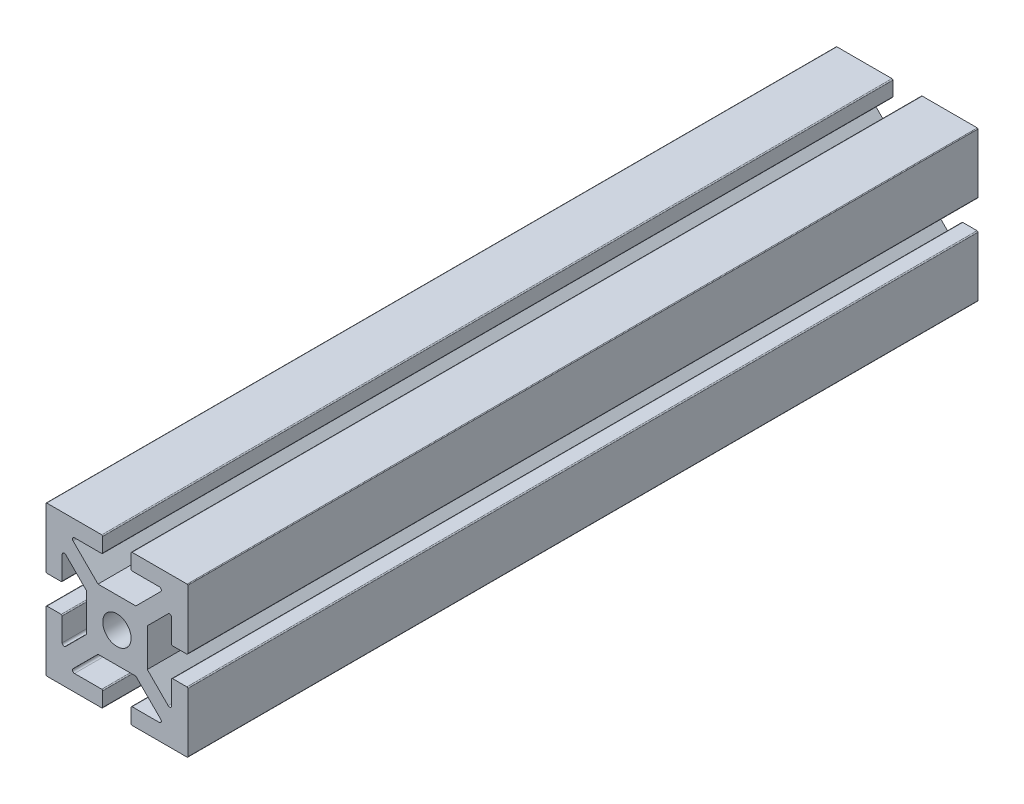
from build123d import *

# Parameters (mm, degrees)
SKETCH1_R           = 3.5
BOSS_EXTRUDE1_DEPTH = 195


with BuildPart() as part:
    # Sketch1 → Boss-Extrude1 (new body)
    with BuildSketch(Plane.XY):
        with BuildLine():
            Line((-7.5, -4.671572875), (-7.5, 4.671572875))
            Line((-7.5, 4.671572875), (-12.646446609, 9.818019485))
            ThreePointArc((-12.646446609, 9.818019485), (-13.191341716, 9.92640586), (-13.5, 9.464466094))
            Line((-13.5, 9.464466094), (-13.5, 3.75))
            ThreePointArc((-13.5, 3.75), (-13.573223305, 3.573223305), (-13.75, 3.5))
            Line((-13.75, 3.5), (-17.25, 3.5))
            ThreePointArc((-17.25, 3.5), (-17.426776695, 3.573223305), (-17.5, 3.75))
            Line((-17.5, 3.75), (-17.5, 18.323223305))
            ThreePointArc((-17.5, 18.323223305), (-17.448223305, 18.448223305), (-17.323223305, 18.5))
            Line((-17.323223305, 18.5), (-3.75, 18.5))
            ThreePointArc((-3.75, 18.5), (-3.573223305, 18.426776695), (-3.5, 18.25))
            Line((-3.5, 18.25), (-3.5, 14.75))
            ThreePointArc((-3.5, 14.75), (-3.573223305, 14.573223305), (-3.75, 14.5))
            Line((-3.75, 14.5), (-10.464466094, 14.5))
            ThreePointArc((-10.464466094, 14.5), (-10.92640586, 14.191341716), (-10.818019485, 13.646446609))
            Line((-10.818019485, 13.646446609), (-4.671572875, 7.5))
            Line((-4.671572875, 7.5), (4.671572875, 7.5))
            Line((4.671572875, 7.5), (10.818019485, 13.646446609))
            ThreePointArc((10.818019485, 13.646446609), (10.92640586, 14.191341716), (10.464466094, 14.5))
            Line((10.464466094, 14.5), (3.75, 14.5))
            ThreePointArc((3.75, 14.5), (3.573223305, 14.573223305), (3.5, 14.75))
            Line((3.5, 14.75), (3.5, 18.25))
            ThreePointArc((3.5, 18.25), (3.573223305, 18.426776695), (3.75, 18.5))
            Line((3.75, 18.5), (17.323223305, 18.5))
            ThreePointArc((17.323223305, 18.5), (17.448223305, 18.448223305), (17.5, 18.323223305))
            Line((17.5, 18.323223305), (17.5, 3.75))
            ThreePointArc((17.5, 3.75), (17.426776695, 3.573223305), (17.25, 3.5))
            Line((17.25, 3.5), (13.75, 3.5))
            ThreePointArc((13.75, 3.5), (13.573223305, 3.573223305), (13.5, 3.75))
            Line((13.5, 3.75), (13.5, 9.464466094))
            ThreePointArc((13.5, 9.464466094), (13.191341716, 9.92640586), (12.646446609, 9.818019485))
            Line((12.646446609, 9.818019485), (7.5, 4.671572875))
            Line((7.5, 4.671572875), (7.5, -4.671572875))
            Line((7.5, -4.671572875), (12.646446609, -9.818019485))
            ThreePointArc((12.646446609, -9.818019485), (13.191341716, -9.92640586), (13.5, -9.464466094))
            Line((13.5, -9.464466094), (13.5, -3.75))
            ThreePointArc((13.5, -3.75), (13.573223305, -3.573223305), (13.75, -3.5))
            Line((13.75, -3.5), (17.25, -3.5))
            ThreePointArc((17.25, -3.5), (17.426776695, -3.573223305), (17.5, -3.75))
            Line((17.5, -3.75), (17.5, -18.323223305))
            ThreePointArc((17.5, -18.323223305), (17.448223305, -18.448223305), (17.323223305, -18.5))
            Line((17.323223305, -18.5), (3.75, -18.5))
            ThreePointArc((3.75, -18.5), (3.573223305, -18.426776695), (3.5, -18.25))
            Line((3.5, -18.25), (3.5, -14.75))
            ThreePointArc((3.5, -14.75), (3.573223305, -14.573223305), (3.75, -14.5))
            Line((3.75, -14.5), (10.464466094, -14.5))
            ThreePointArc((10.464466094, -14.5), (10.92640586, -14.191341716), (10.818019485, -13.646446609))
            Line((10.818019485, -13.646446609), (4.671572875, -7.5))
            Line((4.671572875, -7.5), (-4.671572875, -7.5))
            Line((-4.671572875, -7.5), (-10.818019485, -13.646446609))
            ThreePointArc((-10.818019485, -13.646446609), (-10.92640586, -14.191341716), (-10.464466094, -14.5))
            Line((-10.464466094, -14.5), (-3.75, -14.5))
            ThreePointArc((-3.75, -14.5), (-3.573223305, -14.573223305), (-3.5, -14.75))
            Line((-3.5, -14.75), (-3.5, -18.25))
            ThreePointArc((-3.5, -18.25), (-3.573223305, -18.426776695), (-3.75, -18.5))
            Line((-3.75, -18.5), (-17.323223305, -18.5))
            ThreePointArc((-17.323223305, -18.5), (-17.448223305, -18.448223305), (-17.5, -18.323223305))
            Line((-17.5, -18.323223305), (-17.5, -3.75))
            ThreePointArc((-17.5, -3.75), (-17.426776695, -3.573223305), (-17.25, -3.5))
            Line((-17.25, -3.5), (-13.75, -3.5))
            ThreePointArc((-13.75, -3.5), (-13.573223305, -3.573223305), (-13.5, -3.75))
            Line((-13.5, -3.75), (-13.5, -9.464466094))
            ThreePointArc((-13.5, -9.464466094), (-13.191341716, -9.92640586), (-12.646446609, -9.818019485))
            Line((-12.646446609, -9.818019485), (-7.5, -4.671572875))
        make_face()
        Circle(SKETCH1_R, mode=Mode.SUBTRACT)
    extrude(amount=BOSS_EXTRUDE1_DEPTH)


solid = part.part
